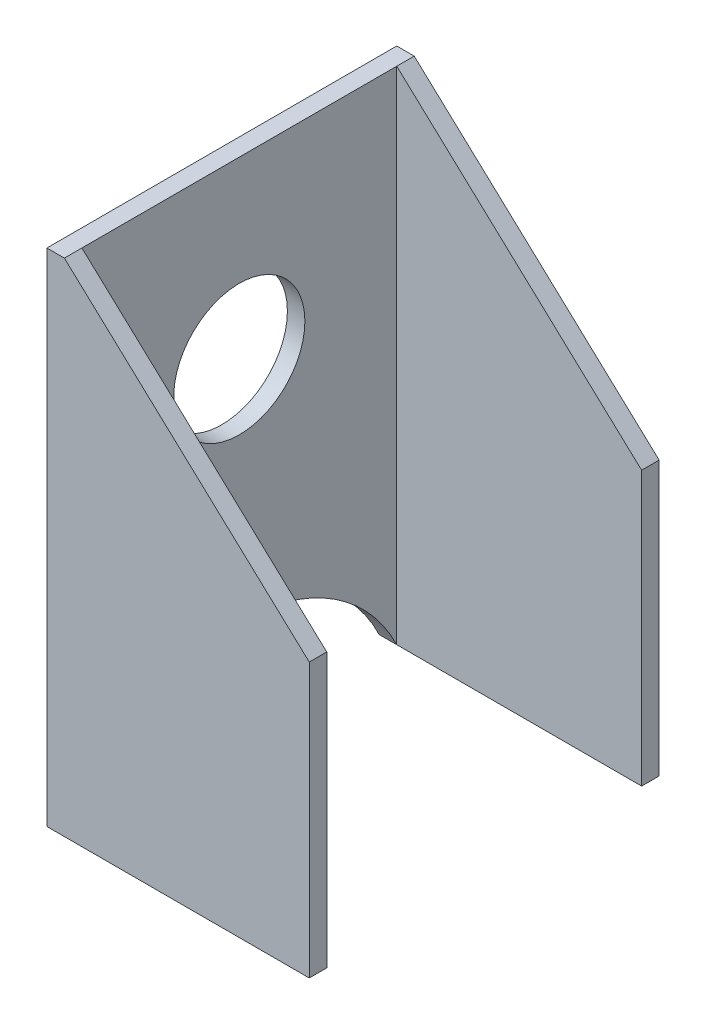
from build123d import *

# Parameters (mm, degrees)
SKETCH1_R           = 4.7625
BOSS_EXTRUDE1_DEPTH = 1.27
SKETCH1_3_W         = 1.27
SKETCH1_3_H         = 36.374198342
BOSS_EXTRUDE2_DEPTH = 19.05
CUT_EXTRUDE1_DEPTH  = 33.02


with BuildPart() as part:
    # Sketch1 → Boss-Extrude1 (new body)
    with BuildSketch(Plane(origin=(0, 0, 0), x_dir=(0, 0, -1), z_dir=(1, 0, 0))):
        with BuildLine():
            Line((11.43, 20.955), (-11.43, 20.955))
            Line((-11.43, 20.955), (-11.43, -15.419198342))
            ThreePointArc((-11.43, -15.419198342), (0, -8.255), (11.43, -15.419198342))
            Line((11.43, -15.419198342), (11.43, 20.955))
        make_face()
        with Locations((0, 8.255)):
            Circle(SKETCH1_R, mode=Mode.SUBTRACT)
    extrude(amount=BOSS_EXTRUDE1_DEPTH)

    # Sketch1<3> → Boss-Extrude2 (add)
    with BuildSketch(Plane(origin=(0, 0, 0), x_dir=(0, 0, -1), z_dir=(1, 0, 0))):
        with Locations((-12.065, 2.767900829)):
            Rectangle(SKETCH1_3_W, SKETCH1_3_H)
        with Locations((12.065, 2.767900829)):
            Rectangle(SKETCH1_3_W, SKETCH1_3_H)
    extrude(amount=BOSS_EXTRUDE2_DEPTH)

    # Sketch2 → Cut-Extrude1 (cut)
    with BuildSketch(Plane.XY.offset(12.7)):
        Polygon((1.27, 20.955), (19.05, 4.445), (19.05, 20.955), align=None)
    extrude(amount=-CUT_EXTRUDE1_DEPTH, mode=Mode.SUBTRACT)


solid = part.part
